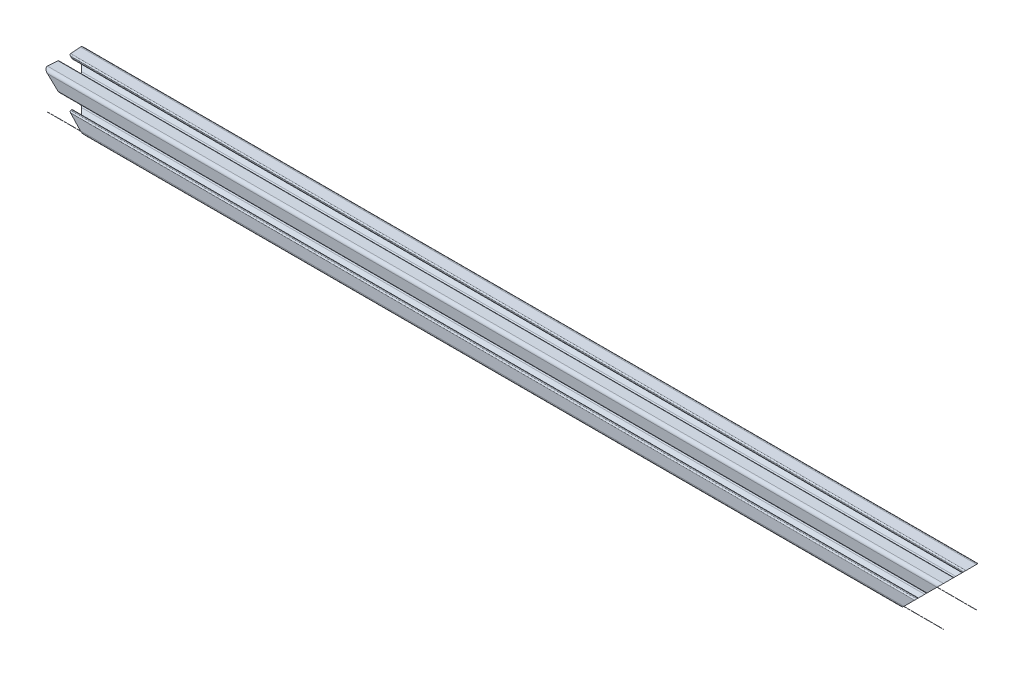
from build123d import *

# Parameters (mm, degrees)
BOSS_EXTRUDE1_DEPTH      = 287.368196
BOSS_EXTRUDE1_DEPTH_BACK = 287.368196
CUT_EXTRUDE5_DEPTH       = 289.76784307
CUT_EXTRUDE5_DEPTH_BACK  = 289.76784307
CUT_EXTRUDE8_DEPTH       = 289.76784307
CUT_EXTRUDE8_DEPTH_BACK  = 289.76784307


with BuildPart() as part:
    # Sketch3 → Boss-Extrude1 (new, two sides: drawn at the far end of the back side and taken through both)
    with BuildSketch(Plane(origin=(0, 0, 0), x_dir=(0, 0, -1), z_dir=(1, 0, 0)).offset(-BOSS_EXTRUDE1_DEPTH_BACK)):
        with BuildLine():
            Line((0, 4.826), (1.984228399, 4.826))
            ThreePointArc((1.984228399, 4.826), (3.199248297, 5.067682484), (4.229292429, 5.75593597))
            Line((4.229292429, 5.75593597), (7.586577723, 9.113221264))
            ThreePointArc((7.586577723, 9.113221264), (7.746562132, 9.955883421), (7.021168939, 10.413572441))
            Line((7.021168939, 10.413572441), (4.090593416, 10.311234489))
            ThreePointArc((4.090593416, 10.311234489), (3.534670322, 10.524633371), (3.302, 11.072770299))
            Line((3.302, 11.072770299), (3.302, 11.70815736))
            ThreePointArc((3.302, 11.70815736), (3.515863072, 12.237487038), (4.037406584, 12.46969317))
            Line((4.037406584, 12.46969317), (10.597084223, 12.698762161))
            ThreePointArc((10.597084223, 12.698762161), (12.104840979, 12.104840979), (12.698762161, 10.597084223))
            Line((12.698762161, 10.597084223), (12.46969317, 4.037406584))
            ThreePointArc((12.46969317, 4.037406584), (12.237487038, 3.515863072), (11.70815736, 3.302))
            Line((11.70815736, 3.302), (11.072770299, 3.302))
            ThreePointArc((11.072770299, 3.302), (10.524633371, 3.534670322), (10.311234489, 4.090593416))
            Line((10.311234489, 4.090593416), (10.413572441, 7.021168939))
            ThreePointArc((10.413572441, 7.021168939), (9.955883421, 7.746562132), (9.113221264, 7.586577723))
            Line((9.113221264, 7.586577723), (5.75593597, 4.229292429))
            ThreePointArc((5.75593597, 4.229292429), (5.067682484, 3.199248297), (4.826, 1.984228399))
            Line((4.826, 1.984228399), (4.826, 0))
            Line((4.826, 0), (2.54, 0))
            ThreePointArc((2.54, 0), (1.796051224, 1.796051224), (0, 2.54))
            Line((0, 2.54), (0, 4.826))
        make_face()
    extrude(amount=BOSS_EXTRUDE1_DEPTH + BOSS_EXTRUDE1_DEPTH_BACK)

    # Mirror1: part across plane


with BuildPart() as part_1:
    add(part.part)
    add(part.part.mirror(Plane.ZX))

    # Mirror2: part across plane


with BuildPart() as part_2:
    add(part_1.part)
    add(part_1.part.mirror(Plane.XY))

    # Sketch6 → Cut-Extrude5 (cut, two sides: drawn at the far end of the back side and taken through both)
    with BuildSketch(Plane(origin=(0, 0, 12.698762161), x_dir=(-1, 0, 0), z_dir=(0, 0, -1)).offset(-CUT_EXTRUDE5_DEPTH_BACK)):
        Polygon((1447.962854837, -12.698762161), (287.3681959, -12.698762161), (261.9681959, -12.698762161), (287.3681959, 12.698762161), (1108.072544542, 833.323118656), (3261.939625853, 1698.641814545), (3601.829936148, 852.619933728), align=None)
    extrude(amount=CUT_EXTRUDE5_DEPTH + CUT_EXTRUDE5_DEPTH_BACK, mode=Mode.SUBTRACT)

    # Sketch12 → Cut-Extrude8 (cut, two sides: drawn at the far end of the back side and taken through both)
    with BuildSketch(Plane(origin=(0, 0, -12.698762161), x_dir=(-1, 0, 0), z_dir=(0, 0, -1)).offset(-CUT_EXTRUDE8_DEPTH_BACK)):
        Polygon((-1447.962854837, -12.698762161), (-287.3681959, -12.698762161), (-261.9681959, -12.698762161), (-287.3681959, 12.698762161), (-1108.072544542, 833.323118656), (-3261.939625853, 1698.641814545), (-3601.829936148, 852.619933728), align=None)
    extrude(amount=CUT_EXTRUDE8_DEPTH + CUT_EXTRUDE8_DEPTH_BACK, mode=Mode.SUBTRACT)


solid = part_2.part
